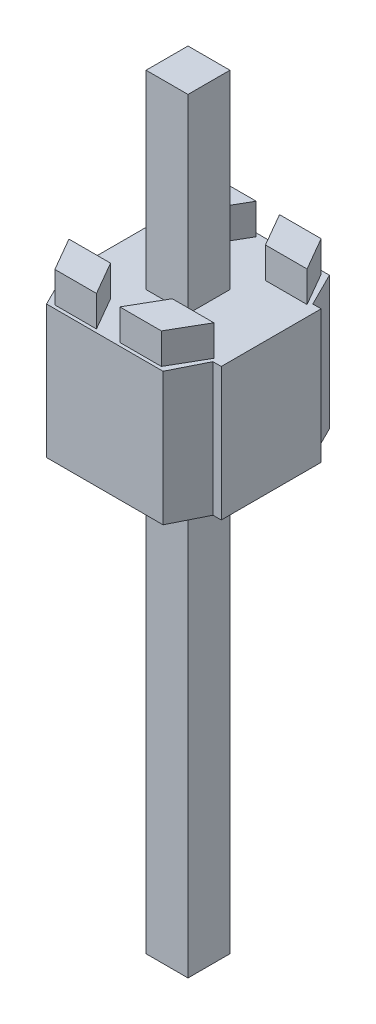
from build123d import *

# Parameters (mm, degrees)
BOSS_EXTRUDE1_DEPTH      = 1.48
BOSS_EXTRUDE1_DEPTH_BACK = 1.02
SKETCH1_W                = 0.64
SKETCH1_H                = 0.64
SKETCH2_OUTSIDE_W        = 5.273
SKETCH2_OUTSIDE_H        = 5.4
CUT_EXTRUDE2_DEPTH       = 0.47
SKETCH3_W                = 0.64
SKETCH3_H                = 0.64
BOSS_EXTRUDE2_DEPTH      = 2.9
SKETCH4_W                = 0.64
SKETCH4_H                = 0.64
BOSS_EXTRUDE3_DEPTH      = 6.75


with BuildPart() as part:
    # Sketch1 → Boss-Extrude1 (new, two sides: drawn at the far end of the back side and taken through both)
    with BuildSketch(Plane(origin=(0, 0, 0), x_dir=(1, 0, 0), z_dir=(0, 1, 0)).offset(-BOSS_EXTRUDE1_DEPTH_BACK)):
        Polygon((-1.143, 0.762), (-0.889, 1.27), (0.889, 1.27), (1.143, 0.762), (1.27, 0.762), (1.27, -0.762), (1.143, -0.762), (0.889, -1.27), (-0.889, -1.27), (-1.143, -0.762), align=None)
        Rectangle(SKETCH1_W, SKETCH1_H, mode=Mode.SUBTRACT)
    extrude(amount=BOSS_EXTRUDE1_DEPTH + BOSS_EXTRUDE1_DEPTH_BACK)

    # Sketch2 outside → Cut-Extrude2 (cut)
    with BuildSketch(Plane(origin=(0, 1.48, 0), x_dir=(1, 0, 0), z_dir=(0, 1, 0))):
        with Locations((0.0635, 0)):
            Rectangle(SKETCH2_OUTSIDE_W, SKETCH2_OUTSIDE_H)
        Polygon((-1.106093937, -0.7112), (-0.471093937, -0.7112), (-0.1778, -1.2192), (-0.8128, -1.2192), align=None, mode=Mode.SUBTRACT)
        Polygon((-0.8128, 1.2192), (-1.106093937, 0.7112), (-0.471093937, 0.7112), (-0.1778, 1.2192), align=None, mode=Mode.SUBTRACT)
        Polygon((1.106093937, 0.7112), (0.471093937, 0.7112), (0.1778, 1.2192), (0.8128, 1.2192), align=None, mode=Mode.SUBTRACT)
        Polygon((0.8128, -1.2192), (1.106093937, -0.7112), (0.471093937, -0.7112), (0.1778, -1.2192), align=None, mode=Mode.SUBTRACT)
    extrude(amount=-CUT_EXTRUDE2_DEPTH, mode=Mode.SUBTRACT)


with BuildPart() as body_2:
    # Sketch3 → Boss-Extrude2 (new body)
    with BuildSketch(Plane(origin=(0, 1.01, 0), x_dir=(1, 0, 0), z_dir=(0, 1, 0))):
        Rectangle(SKETCH3_W, SKETCH3_H)
    extrude(amount=BOSS_EXTRUDE2_DEPTH)


with BuildPart() as body_3:
    # Sketch4 → Boss-Extrude3 (new body)
    with BuildSketch(Plane.XZ.offset(1.02)):
        Rectangle(SKETCH4_W, SKETCH4_H)
    extrude(amount=BOSS_EXTRUDE3_DEPTH)


solid = Compound([part.part, body_2.part, body_3.part])
